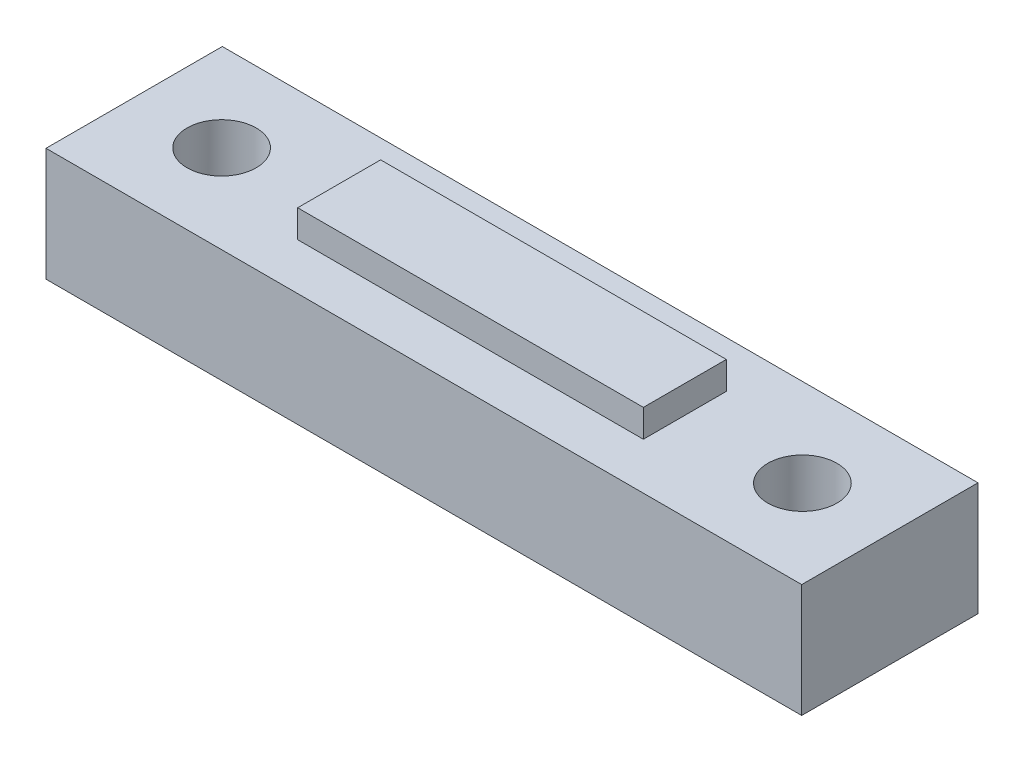
from build123d import *

# Parameters (mm, degrees)
SKETCH1_W           = 54.65
SKETCH1_H           = 12.75
BOSS_EXTRUDE1_DEPTH = 8.2
SKETCH2_R           = 2.5
CUT_EXTRUDE2_DEPTH  = 10
SKETCH3_W           = 25
SKETCH3_H           = 6
BOSS_EXTRUDE2_DEPTH = 2


with BuildPart() as part:
    # Sketch1 → Boss-Extrude1 (new body)
    with BuildSketch(Plane(origin=(0, 0, 0), x_dir=(1, 0, 0), z_dir=(0, 1, 0))):
        with Locations((27.325, 6.375)):
            Rectangle(SKETCH1_W, SKETCH1_H)
    extrude(amount=BOSS_EXTRUDE1_DEPTH)

    # Sketch2 → Cut-Extrude2 (cut)
    with BuildSketch(Plane(origin=(0, 8.2, 0), x_dir=(1, 0, 0), z_dir=(0, 1, 0))):
        with Locations(Location((6.325, 6.375, 0), (0, 0, 270))):
            Circle(SKETCH2_R)
        with Locations(Location((48.325, 6.375, 0), (0, 0, 270))):
            Circle(SKETCH2_R)
    extrude(amount=-CUT_EXTRUDE2_DEPTH, mode=Mode.SUBTRACT)

    # Sketch3 → Boss-Extrude2 (add)
    with BuildSketch(Plane(origin=(0, 8.2, 0), x_dir=(1, 0, 0), z_dir=(0, 1, 0))):
        with Locations((27.325, 6.375)):
            Rectangle(SKETCH3_W, SKETCH3_H)
    extrude(amount=BOSS_EXTRUDE2_DEPTH)


solid = part.part
